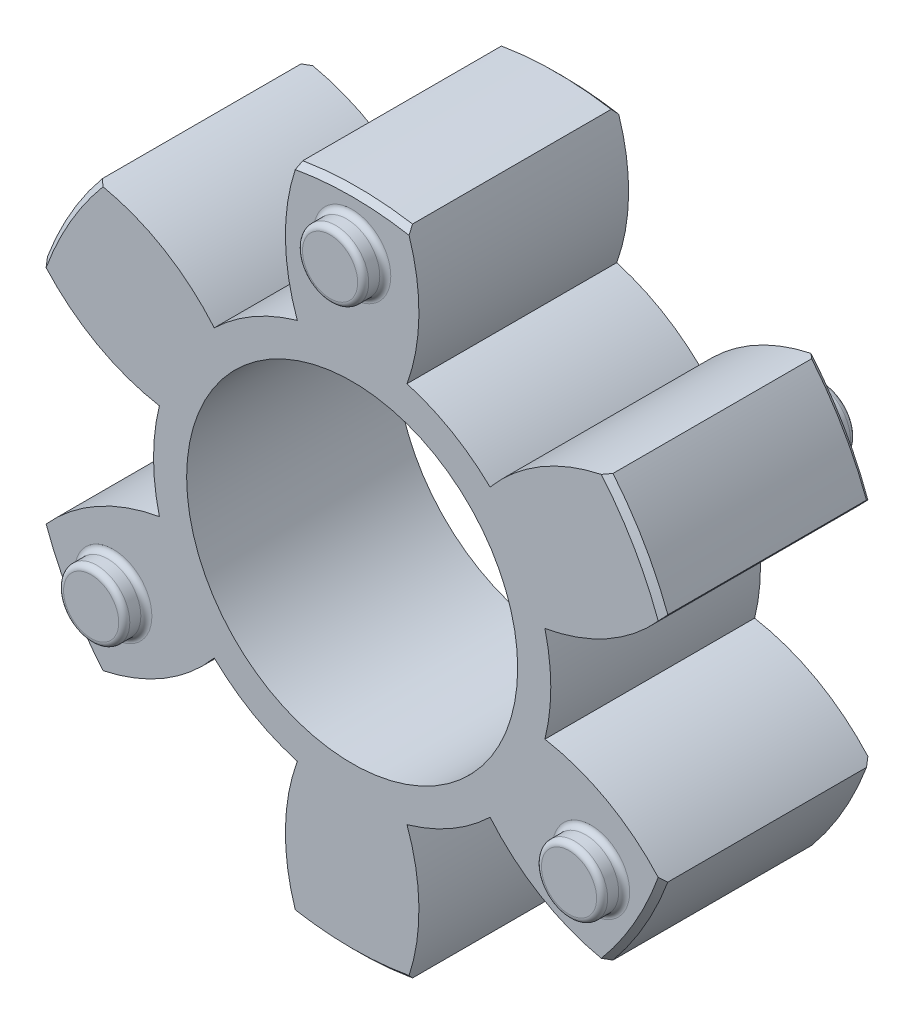
from build123d import *

# Parameters (mm, degrees)
SKETCH1_R           = 7.5
SKETCH1_R_2         = 1.5
BOSS_EXTRUDE1_DEPTH = 9.5
SKETCH1_4_R         = 1.5
BOSS_EXTRUDE2_DEPTH = 10.5
FILLET1_R           = 0.25
CHAMFER1_SIZE       = 0.25
SKETCH2_R           = 1.5
BOSS_EXTRUDE3_DEPTH = 1
FILLET2_R           = 0.25


with BuildPart() as part:
    # Sketch1 → Boss-Extrude1 (new body)
    with BuildSketch(Plane.XY):
        with BuildLine():
            ThreePointArc((-11.568377458, 9.548436677), (-12.990381057, 7.5), (-14.053377458, 5.244290421))
            ThreePointArc((-14.053377458, 5.244290421), (-11.663687642, 3.240759001), (-8.733733627, 2.172992623))
            ThreePointArc((-8.733733627, 2.172992623), (-9, 0), (-8.733733627, -2.172992623))
            ThreePointArc((-8.733733627, -2.172992623), (-11.663687642, -3.240759001), (-14.053377458, -5.244290421))
            ThreePointArc((-14.053377458, -5.244290421), (-12.990381057, -7.5), (-11.568377458, -9.548436677))
            ThreePointArc((-11.568377458, -9.548436677), (-8.638423443, -8.480670299), (-6.248733627, -6.477138879))
            ThreePointArc((-6.248733627, -6.477138879), (-4.5, -7.794228634), (-2.485, -8.650131502))
            ThreePointArc((-2.485, -8.650131502), (-3.025264198, -11.7214293), (-2.485, -14.792727098))
            ThreePointArc((-2.485, -14.792727098), (0, -15), (2.485, -14.792727098))
            ThreePointArc((2.485, -14.792727098), (3.025264198, -11.7214293), (2.485, -8.650131502))
            ThreePointArc((2.485, -8.650131502), (4.5, -7.794228634), (6.248733627, -6.477138879))
            ThreePointArc((6.248733627, -6.477138879), (8.638423443, -8.480670299), (11.568377458, -9.548436677))
            ThreePointArc((11.568377458, -9.548436677), (12.990381057, -7.5), (14.053377458, -5.244290421))
            ThreePointArc((14.053377458, -5.244290421), (11.663687642, -3.240759001), (8.733733627, -2.172992623))
            ThreePointArc((8.733733627, -2.172992623), (9, 0), (8.733733627, 2.172992623))
            ThreePointArc((8.733733627, 2.172992623), (11.663687642, 3.240759001), (14.053377458, 5.244290421))
            ThreePointArc((14.053377458, 5.244290421), (12.990381057, 7.5), (11.568377458, 9.548436677))
            ThreePointArc((11.568377458, 9.548436677), (8.638423443, 8.480670299), (6.248733627, 6.477138879))
            ThreePointArc((6.248733627, 6.477138879), (4.5, 7.794228634), (2.485, 8.650131502))
            ThreePointArc((2.485, 8.650131502), (3.025264198, 11.7214293), (2.485, 14.792727098))
            ThreePointArc((2.485, 14.792727098), (0, 15), (-2.485, 14.792727098))
            ThreePointArc((-2.485, 14.792727098), (-3.025264198, 11.7214293), (-2.485, 8.650131502))
            ThreePointArc((-2.485, 8.650131502), (-4.5, 7.794228634), (-6.248733627, 6.477138879))
            ThreePointArc((-6.248733627, 6.477138879), (-8.638423443, 8.480670299), (-11.568377458, 9.548436677))
        make_face()
        Circle(SKETCH1_R, mode=Mode.SUBTRACT)
        with Locations((0, 12.5)):
            Circle(SKETCH1_R_2, mode=Mode.SUBTRACT)
        with Locations((10.825317547, -6.25)):
            Circle(SKETCH1_R_2, mode=Mode.SUBTRACT)
        with Locations((-10.825317547, -6.25)):
            Circle(SKETCH1_R_2, mode=Mode.SUBTRACT)
    extrude(amount=BOSS_EXTRUDE1_DEPTH)

    # Sketch1<4> → Boss-Extrude2 (add)
    with BuildSketch(Plane.XY):
        with Locations((0, 12.5)):
            Circle(SKETCH1_4_R)
        with Locations((10.825317547, -6.25)):
            Circle(SKETCH1_4_R)
        with Locations((-10.825317547, -6.25)):
            Circle(SKETCH1_4_R)
    extrude(amount=BOSS_EXTRUDE2_DEPTH)

    # Fillet1
    fillet1_edges = [part.edges().sort_by_distance(p)[0] for p in [
        (9.325317547, -6.25, 10.5),
        (-1.5, 12.5, 10.5),
        (-12.325317547, -6.25, 10.5),
        (-1.5, 12.5, 9.5),
        (9.325317547, -6.25, 9.5),
        (-12.325317547, -6.25, 9.5),
    ]]
    fillet(fillet1_edges, radius=FILLET1_R)

    # Chamfer1
    chamfer1_edges = [part.edges().sort_by_distance(p)[0] for p in [
        (12.990381057, -7.5, 9.5),
        (0, -15, 9.5),
        (-12.990381057, -7.5, 9.5),
        (-12.990381057, 7.5, 9.5),
        (0, 15, 9.5),
        (12.990381057, 7.5, 9.5),
        (-12.990381057, 7.5, 0),
        (-12.990381057, -7.5, 0),
        (0, -15, 0),
        (12.990381057, -7.5, 0),
        (12.990381057, 7.5, 0),
        (0, 15, 0),
    ]]
    chamfer(chamfer1_edges, length=CHAMFER1_SIZE)

    # Sketch2 → Boss-Extrude3 (add)
    with BuildSketch(Plane(origin=(0, 0, 0), x_dir=(-1, 0, 0), z_dir=(0, 0, -1))):
        with Locations((0, -12.5)):
            Circle(SKETCH2_R)
        with Locations((-10.825317547, 6.25)):
            Circle(SKETCH2_R)
        with Locations((10.825317547, 6.25)):
            Circle(SKETCH2_R)
    extrude(amount=BOSS_EXTRUDE3_DEPTH)

    # Fillet2
    fillet2_edges = [part.edges().sort_by_distance(p)[0] for p in [
        (1.5, -12.5, 0),
        (1.5, -12.5, -1),
        (12.325317547, 6.25, 0),
        (12.325317547, 6.25, -1),
        (-9.325317547, 6.25, 0),
        (-9.325317547, 6.25, -1),
    ]]
    fillet(fillet2_edges, radius=FILLET2_R)


solid = part.part
